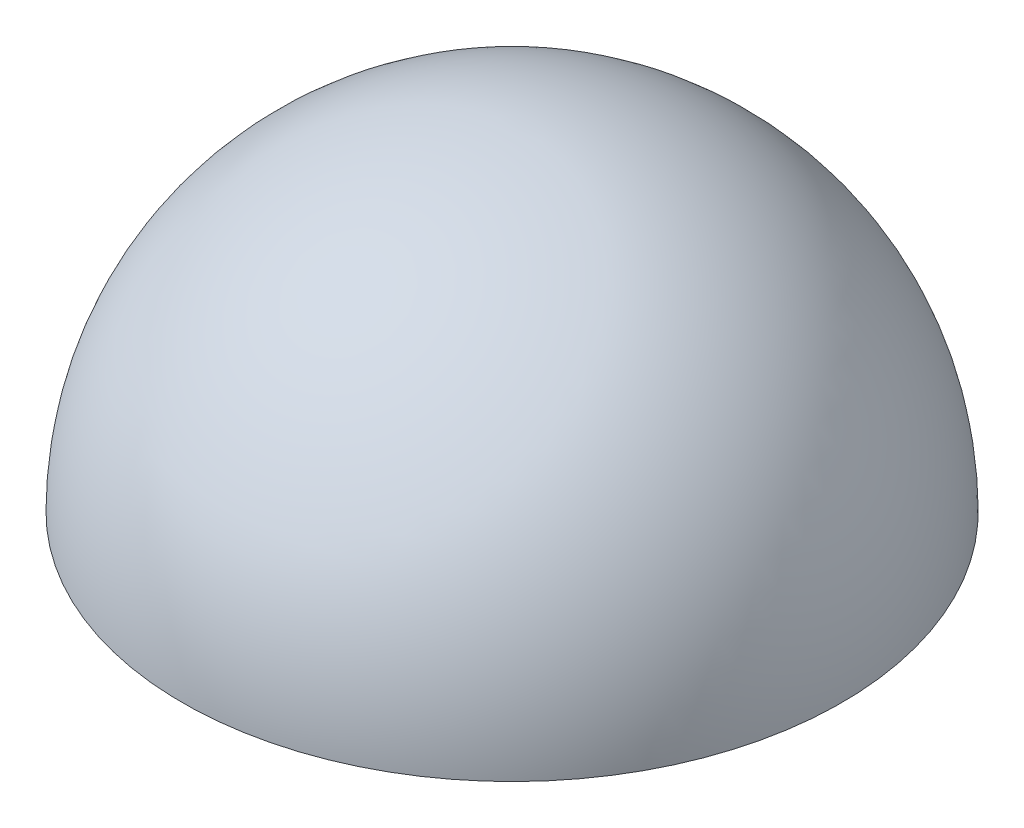
from build123d import *

# Parameters (mm, degrees)
REVOLVE1_ANGLE = 180


with BuildPart() as part:
    # Sketch4 → Revolve1 (revolve)
    with BuildSketch(Plane(origin=(0, 0, 0), x_dir=(1, 0, 0), z_dir=(0, 1, 0))):
        with BuildLine():
            ThreePointArc((-9.525, 0), (0, 9.525), (9.525, 0))
            Line((9.525, 0), (-9.525, 0))
        make_face()
    revolve(axis=Axis((-9.525, 0, 0), (1, 0, 0)), revolution_arc=REVOLVE1_ANGLE)


solid = part.part
